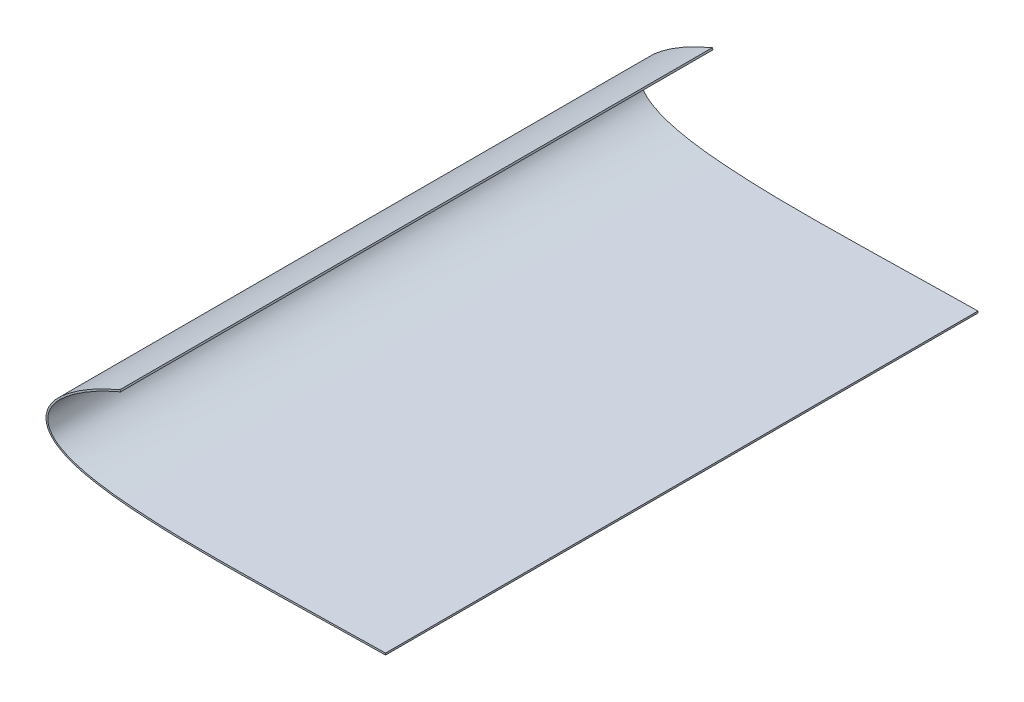
from build123d import *

# Parameters (mm, degrees)
BOSS_EXTRUDE1_DEPTH = 174.625


with BuildPart() as part:
    # Sketch2 → Boss-Extrude1 (new body)
    with BuildSketch(Plane.XY):
        with BuildLine():
            Line((52.450966591, 54.156690392), (52.279784263, 54.636849558))
            add(Edge.make_bspline(
                [(52.279784263, 54.636849558), (51.984237584, 54.511056821), (50.769870335, 53.98733611), (48.726284221, 53.036537204), (46.198596634, 51.785614981), (43.851395534, 50.562835734), (41.706522315, 49.275390999), (39.733394776, 48.029285981), (37.96601505, 46.750863313), (36.354256942, 45.554262029), (34.950604239, 44.324720652), (33.731005853, 43.137552945), (32.687540062, 41.964696774), (31.870049495, 40.795098076), (31.204908104, 39.656920775), (30.808603368, 38.519610424), (30.523569136, 37.434538913), (30.431008783, 36.362784079), (30.615024145, 35.329347542), (30.892786526, 34.31776167), (31.44961021, 33.393225815), (32.150652535, 32.523415034), (32.976658961, 31.650611998), (34.071745031, 30.944142433), (35.274330147, 30.214742482), (36.660691022, 29.558588434), (38.229863976, 28.979587438), (39.960327495, 28.409153359), (41.862111381, 27.907689258), (43.930829494, 27.476813607), (46.143058676, 27.054479883), (48.526108809, 26.711860726), (51.044567861, 26.394902704), (53.722663067, 26.066490372), (56.551232084, 25.916200458), (59.520788519, 25.669657839), (62.6352899, 25.564258659), (65.882911732, 25.378110786), (69.272721395, 25.311702125), (72.787592693, 25.244722742), (76.441016853, 25.21775368), (80.207956115, 25.205925557), (84.09958906, 25.254280801), (88.093376993, 25.234404524), (92.209483276, 25.367323441), (96.427933939, 25.370472209), (100.757397227, 25.449136698), (105.174516489, 25.554734077), (109.691566336, 25.647087119), (114.294867366, 25.736248002), (118.998236923, 25.802219339), (123.786466613, 25.937600392), (127.652050322, 25.978617474), (129.916088327, 26.006287555), (130.555209424, 26.014321885)],
                knots=[14.134429208, 14.134429208, 14.134429208, 14.134429208, 14.172367831, 14.290636843, 14.400564275, 14.505491459, 14.603093306, 14.695949765, 14.781006513, 14.860666874, 14.932933187, 15.001195019, 15.061639724, 15.117977566, 15.169575709, 15.216704545, 15.259669247, 15.302009247, 15.342390852, 15.383061745, 15.425174584, 15.468583505, 15.515143544, 15.566222682, 15.62172189, 15.681367848, 15.746954194, 15.819191005, 15.896502106, 15.979092178, 16.068736654, 16.162461377, 16.26337051, 16.36858172, 16.48100172, 16.59780172, 16.720476477, 16.848989655, 16.981977945, 17.120869917, 17.264217829, 17.413488104, 17.565776672, 17.723888673, 17.885150944, 18.052108822, 18.222096968, 18.396577658, 18.573966156, 18.755717098, 18.940376799, 19.129529928, 19.321463018, 19.396955855, 19.396955855, 19.396955855, 19.396955855], degree=3))
            Line((130.555209424, 26.014321885), (130.548667938, 26.534689034))
            add(Edge.make_bspline(
                [(52.450966591, 54.156690392), (52.331226703, 54.10460272), (52.211575134, 54.05231621), (48.598513497, 52.466209621), (45.148921663, 50.790800121), (39.569261895, 47.362088597), (37.29377419, 45.768666391), (33.64893293, 42.421797821), (32.150591155, 40.693937136), (30.974016316, 37.487201054), (30.841708434, 36.186315488), (31.636890757, 33.810556773), (32.494746255, 32.761333487), (34.364828507, 31.278960233), (35.385859188, 30.721401098), (37.422700797, 29.782300565), (38.50926311, 29.411592642), (41.888932576, 28.353918567), (44.253121805, 27.893924884), (49.005561472, 27.118358305), (51.404688059, 26.852581479), (58.633206362, 26.211091567), (63.469821915, 25.957744334), (73.154400086, 25.727718088), (77.996906352, 25.716461468), (92.764217068, 25.800424994), (102.66399777, 26.030813252), (118.563284111, 26.314315951), (124.555343757, 26.44910264), (130.548667938, 26.534689034)],
                knots=[14.135708649, 14.135708649, 14.135708649, 14.135708649, 14.151211266, 14.151211266, 14.60418364, 14.60418364, 14.932415743, 14.932415743, 15.199764537, 15.199764537, 15.36293217, 15.36293217, 15.526099802, 15.526099802, 15.662859963, 15.662859963, 15.799620124, 15.799620124, 16.08612483, 16.08612483, 16.372629537, 16.372629537, 16.94563895, 16.94563895, 17.518648363, 17.518648363, 18.689255122, 18.689255122, 19.396986742, 19.396986742, 19.396986742, 19.396986742], degree=3))
        make_face()
    extrude(amount=BOSS_EXTRUDE1_DEPTH)


solid = part.part
